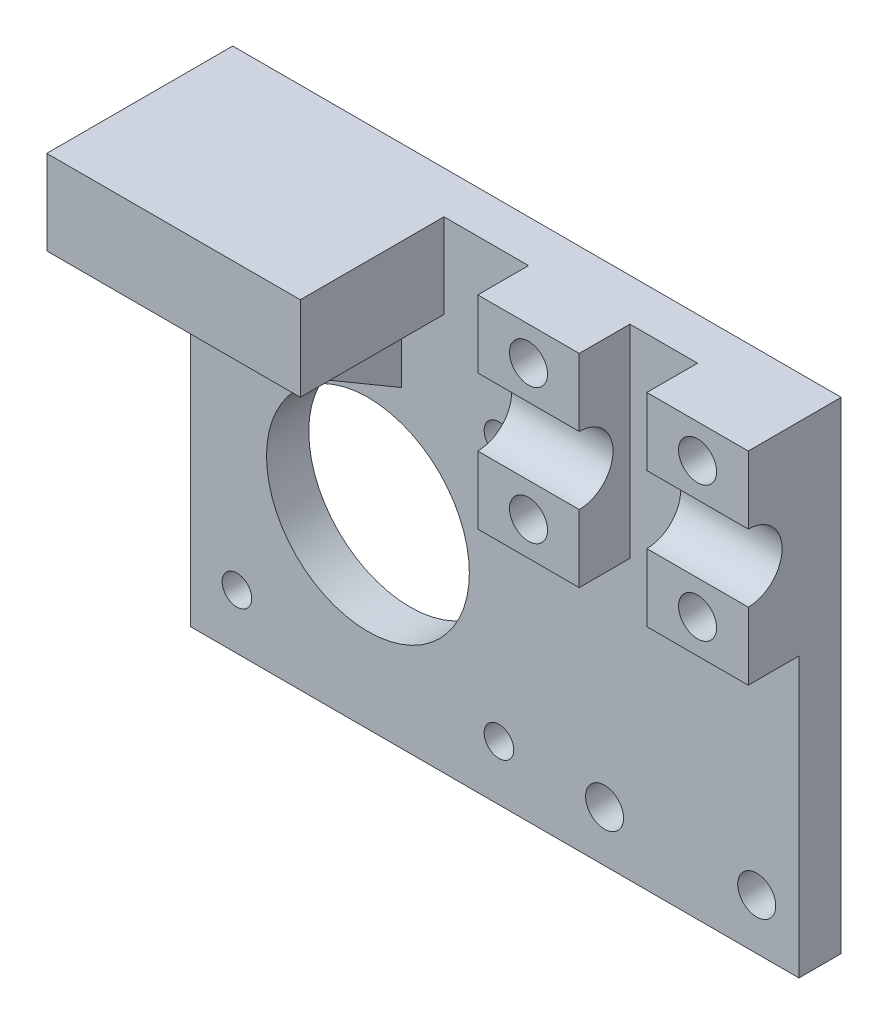
from build123d import *

# Parameters (mm, degrees)
SKETCH1_W           = 72
SKETCH1_H           = 57
BOSS_EXTRUDE1_DEPTH = 5
BOSS_EXTRUDE2_DEPTH = 12
SKETCH5_R           = 2.25
CUT_EXTRUDE2_DEPTH  = 64.790673299
SKETCH4_R           = 12
SKETCH4_R_2         = 1.75
CUT_EXTRUDE1_DEPTH  = 64.120915709
SKETCH6_R           = 2.25
CUT_EXTRUDE3_DEPTH  = 64.120915709
SKETCH7_W           = 30
SKETCH7_H           = 10
BOSS_EXTRUDE3_DEPTH = 17
BOSS_EXTRUDE4_START = -5
BOSS_EXTRUDE4_DEPTH = 5
SKETCH9_W           = 10
SKETCH9_H           = 3
CUT_EXTRUDE4_DEPTH  = 66.094162565


with BuildPart() as part:
    # Sketch1 → Boss-Extrude1 (new body)
    with BuildSketch(Plane.XY):
        with Locations((-20, 0)):
            Rectangle(SKETCH1_W, SKETCH1_H)
    extrude(amount=BOSS_EXTRUDE1_DEPTH)

    # Sketch3 → Boss-Extrude2 (add)
    with BuildSketch(Plane(origin=(16, 0, 0), x_dir=(0, 0, -1), z_dir=(1, 0, 0))):
        with BuildLine():
            Line((-5, 28.5), (-11, 28.5))
            Line((-11, 28.5), (-11, 20.5))
            ThreePointArc((-11, 20.5), (-7, 16.5), (-11, 12.5))
            Line((-11, 12.5), (-11, 4.5))
            Line((-11, 4.5), (-5, 4.5))
            Line((-5, 4.5), (-5, 28.5))
        make_face()
    boss_extrude2 = extrude(amount=-BOSS_EXTRUDE2_DEPTH)

    # Sketch5 → Cut-Extrude2 (cut, through all)
    with BuildSketch(Plane.XY.offset(11)):
        with Locations((10, 24.5)):
            Circle(SKETCH5_R)
        with Locations((10, 8.5)):
            Circle(SKETCH5_R)
    cut_extrude2 = extrude(amount=-CUT_EXTRUDE2_DEPTH, mode=Mode.SUBTRACT)

    # Mirror1: Boss-Extrude2, Cut-Extrude2 across plane
    add(boss_extrude2.mirror(Plane(origin=(0, 0, 0), x_dir=(0, 0, 1), z_dir=(1, 0, 0))))
    add(cut_extrude2.mirror(Plane(origin=(0, 0, 0), x_dir=(0, 0, 1), z_dir=(1, 0, 0))), mode=Mode.SUBTRACT)

    # Sketch4 → Cut-Extrude1 (cut, through all)
    with BuildSketch(Plane.XY.offset(5)):
        with Locations((-35, -6.5)):
            Circle(SKETCH4_R)
        with Locations((-50.5, 9)):
            Circle(SKETCH4_R_2)
        with Locations((-19.5, 9)):
            Circle(SKETCH4_R_2)
        with Locations((-19.5, -22)):
            Circle(SKETCH4_R_2)
        with Locations((-50.5, -22)):
            Circle(SKETCH4_R_2)
    extrude(amount=-CUT_EXTRUDE1_DEPTH, mode=Mode.SUBTRACT)

    # Sketch6 → Cut-Extrude3 (cut, through all)
    with BuildSketch(Plane.XY.offset(5)):
        with Locations((-7, -22.5)):
            Circle(SKETCH6_R)
        with Locations((11, -22.5)):
            Circle(SKETCH6_R)
    extrude(amount=-CUT_EXTRUDE3_DEPTH, mode=Mode.SUBTRACT)

    # Sketch7 → Boss-Extrude3 (add)
    with BuildSketch(Plane.XY.offset(5)):
        with Locations((-41, 23.5)):
            Rectangle(SKETCH7_W, SKETCH7_H)
    extrude(amount=BOSS_EXTRUDE3_DEPTH)

    # Sketch8 → Boss-Extrude4 (add)
    with BuildSketch(Plane(origin=(-26, 0, 0), x_dir=(0, 0, -1), z_dir=(1, 0, 0)).offset(BOSS_EXTRUDE4_START)):
        Polygon((-22, 18.5), (-5, 8.5), (-5, 18.5), align=None)
    extrude(amount=-BOSS_EXTRUDE4_DEPTH)

    # Sketch9 → Cut-Extrude4 (cut, through all)
    with BuildSketch(Plane.XY.offset(5)):
        with Locations((-41, 17)):
            Rectangle(SKETCH9_W, SKETCH9_H)
    extrude(amount=-CUT_EXTRUDE4_DEPTH, mode=Mode.SUBTRACT)


solid = part.part
